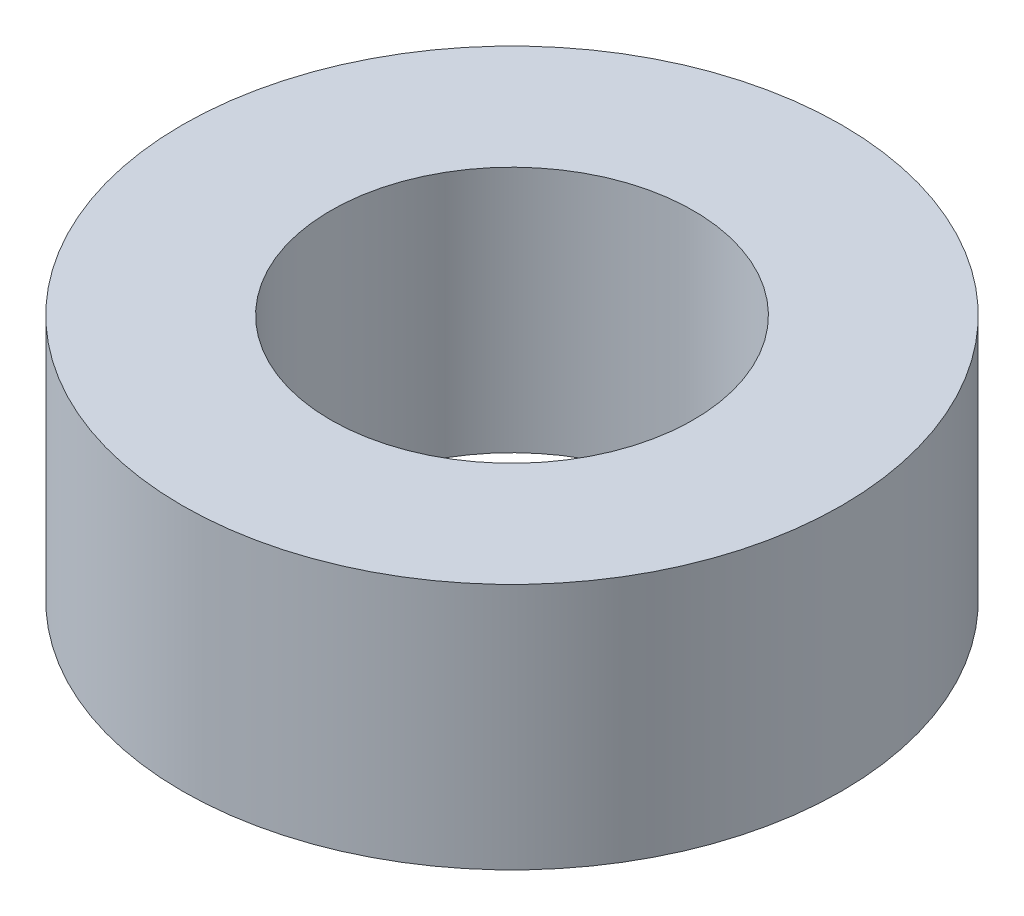
from build123d import *

# Parameters (mm, degrees)
SKETCH1_R           = 4
BOSS_EXTRUDE1_DEPTH = 3
SKETCH2_R           = 2.2
CUT_EXTRUDE1_DEPTH  = 3


with BuildPart() as part:
    # Sketch1 → Boss-Extrude1 (new body)
    with BuildSketch(Plane(origin=(0, 0, 0), x_dir=(1, 0, 0), z_dir=(0, 1, 0))):
        with Locations(Location((0, 0, 0), (0, 0, 270))):
            Circle(SKETCH1_R)
    extrude(amount=BOSS_EXTRUDE1_DEPTH)

    # Sketch2 → Cut-Extrude1 (cut)
    with BuildSketch(Plane(origin=(0, 3, 0), x_dir=(1, 0, 0), z_dir=(0, 1, 0))):
        with Locations(Location((0, 0, 0), (0, 0, 270))):
            Circle(SKETCH2_R)
    extrude(amount=-CUT_EXTRUDE1_DEPTH, mode=Mode.SUBTRACT)


solid = part.part
